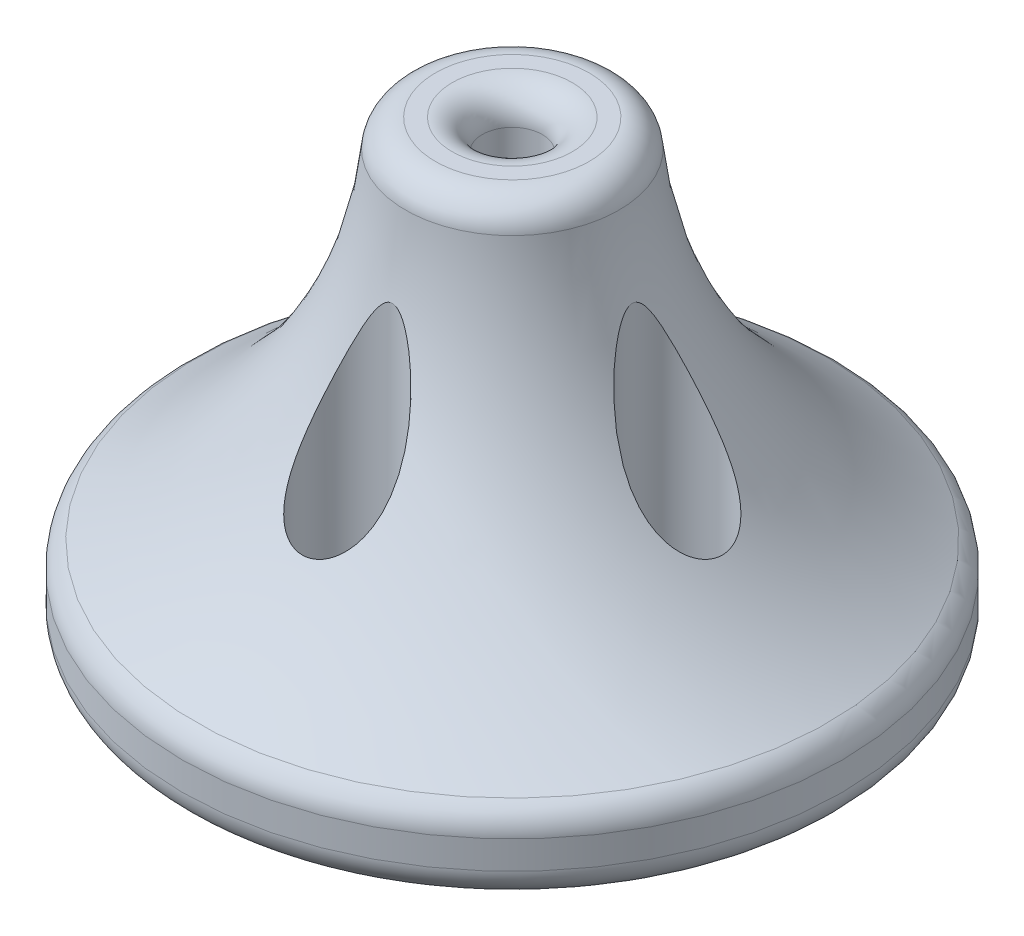
from build123d import *

# Parameters (mm, degrees)
CROQUIS2_R            = 3
CORTAR_EXTRUIR1_DEPTH = 60


with BuildPart() as part:
    # Croquis1 → Revolución1 (revolve)
    with BuildSketch(Plane.XY, mode=Mode.PRIVATE) as revoluci_n1_sk:
        with BuildLine():
            Line((-4, 0), (-20, 0))
            ThreePointArc((-20, 0), (-21.414213562, 0.585786438), (-22, 2))
            Line((-22, 2), (-22, 3.869066244))
            ThreePointArc((-22, 3.869066244), (-21.749708086, 4.837839496), (-21.061478387, 5.564136636))
            ThreePointArc((-21.061478387, 5.564136636), (-11.446443232, 15.246912796), (-7.114916718, 28.186887032))
            ThreePointArc((-7.114916718, 28.186887032), (-6.470186386, 29.47881271), (-5.123667553, 30))
            Line((-5.123667553, 30), (-4, 30))
            ThreePointArc((-4, 30), (-2.585786438, 29.414213562), (-2, 28))
            Line((-2, 28), (-2, 2))
            ThreePointArc((-2, 2), (-2.585786438, 0.585786438), (-4, 0))
        make_face()
    revolve(revoluci_n1_sk.sketch.rotate(Axis((0, 0, 0), (0, 1, 0)), 270), axis=Axis((0, 0, 0), (0, 1, 0)))

    # Croquis2 → Cortar-Extruir1 (cut)
    with BuildSketch(Plane.XZ):
        with Locations(Location((-11, 0, 0), (0, 0, 270))):
            Circle(CROQUIS2_R)
        with Locations(Location((11, 0, 0), (0, 0, 340.396137661))):
            Circle(CROQUIS2_R)
        with Locations(Location((0, 11, 0), (0, 0, 270))):
            Circle(CROQUIS2_R)
        with Locations(Location((0, -11, 0), (0, 0, 270.000000649))):
            Circle(CROQUIS2_R)
    extrude(amount=-CORTAR_EXTRUIR1_DEPTH, mode=Mode.SUBTRACT)


solid = part.part
